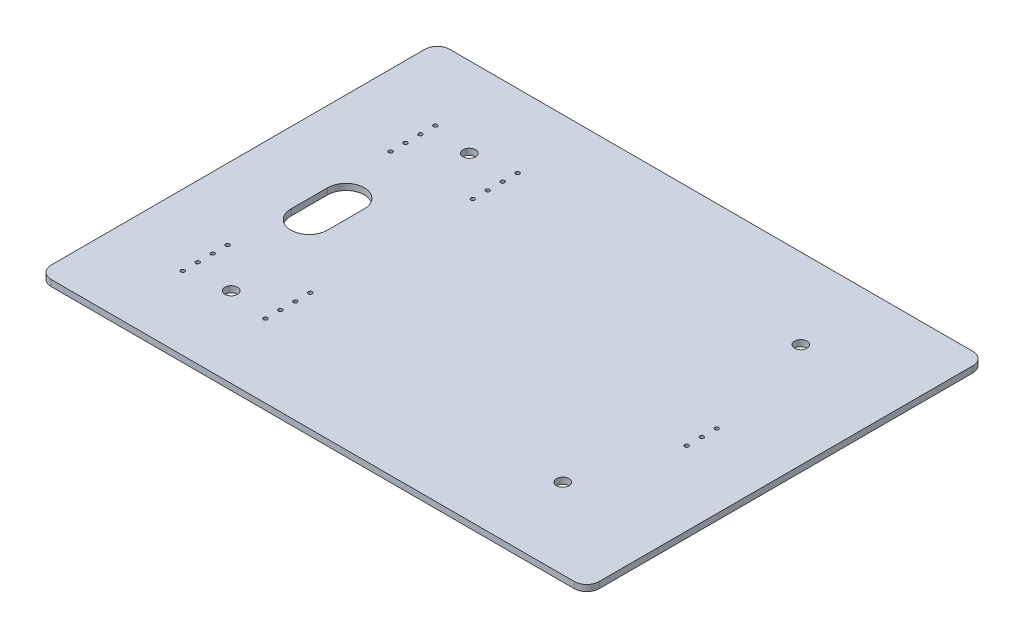
from build123d import *

# Parameters (mm, degrees)
SKETCH1_W           = 139.7
SKETCH1_H           = 101.6
BOSS_EXTRUDE1_DEPTH = 1.5875
SKETCH2_R           = 0.5
SKETCH2_R_2         = 1.5875
CUT_EXTRUDE1_DEPTH  = 87.735242522
CUT_EXTRUDE2_DEPTH  = 87.735242522
FILLET1_R           = 3.175


with BuildPart() as part:
    # Sketch1 → Boss-Extrude1 (new body)
    with BuildSketch(Plane(origin=(0, 0, 0), x_dir=(1, 0, 0), z_dir=(0, 1, 0))):
        with Locations((0.434010551, 0)):
            Rectangle(SKETCH1_W, SKETCH1_H)
    extrude(amount=-BOSS_EXTRUDE1_DEPTH)

    # Sketch2 → Cut-Extrude1 (cut, through all)
    with BuildSketch(Plane(origin=(0, 0, 0), x_dir=(1, 0, 0), z_dir=(0, 1, 0))):
        with Locations(Location((-51.22545, 24.505, 0), (0, 0, 270))):
            Circle(SKETCH2_R)
        with Locations(Location((-30.27045, 28.315, 0), (0, 0, 270))):
            Circle(SKETCH2_R)
        with Locations(Location((-30.27045, 32.125, 0), (0, 0, 270))):
            Circle(SKETCH2_R)
        with Locations(Location((-30.27045, -32.135, 0), (0, 0, 270))):
            Circle(SKETCH2_R)
        with Locations(Location((-30.27045, -28.325, 0), (0, 0, 270))):
            Circle(SKETCH2_R)
        with Locations(Location((-30.27045, -24.515, 0), (0, 0, 270))):
            Circle(SKETCH2_R)
        with Locations(Location((-30.27045, -20.705, 0), (0, 0, 270))):
            Circle(SKETCH2_R)
        with Locations(Location((51.47945, -6.483, 0), (0, 0, 270))):
            Circle(SKETCH2_R)
        with Locations(Location((51.47945, -2.673, 0), (0, 0, 270))):
            Circle(SKETCH2_R)
        with Locations(Location((-51.22545, 28.315, 0), (0, 0, 270))):
            Circle(SKETCH2_R)
        with Locations(Location((-51.22545, 32.125, 0), (0, 0, 270))):
            Circle(SKETCH2_R)
        with Locations(Location((-51.35245, -32.135, 0), (0, 0, 270))):
            Circle(SKETCH2_R)
        with Locations(Location((-51.35245, -28.325, 0), (0, 0, 270))):
            Circle(SKETCH2_R)
        with Locations(Location((-51.35245, -24.515, 0), (0, 0, 270))):
            Circle(SKETCH2_R)
        with Locations(Location((-51.35245, -20.705, 0), (0, 0, 270))):
            Circle(SKETCH2_R)
        with Locations(Location((-30.27045, 20.695, 0), (0, 0, 270))):
            Circle(SKETCH2_R)
        with Locations(Location((-30.27045, 24.505, 0), (0, 0, 270))):
            Circle(SKETCH2_R)
        with Locations(Location((-40.78945, -30.35, 0), (0, 0, 270))):
            Circle(SKETCH2_R_2)
        with Locations(Location((-40.78945, 30.35, 0), (0, 0, 270))):
            Circle(SKETCH2_R_2)
        with Locations(Location((43.71055, 30.35, 0), (0, 0, 270))):
            Circle(SKETCH2_R_2)
        with Locations(Location((43.71055, -30.35, 0), (0, 0, 270))):
            Circle(SKETCH2_R_2)
        with Locations(Location((51.47945, 1.137, 0), (0, 0, 270))):
            Circle(SKETCH2_R)
        with Locations(Location((-51.22545, 20.695, 0), (0, 0, 270))):
            Circle(SKETCH2_R)
    extrude(amount=-CUT_EXTRUDE1_DEPTH, mode=Mode.SUBTRACT)

    # Sketch3 → Cut-Extrude2 (cut, through all)
    with BuildSketch(Plane(origin=(0, 0, 0), x_dir=(1, 0, 0), z_dir=(0, 1, 0))):
        with BuildLine():
            Line((-41.912921413, 4.689952831), (-41.912921413, -4.689952831))
            ThreePointArc((-41.912921413, -4.689952831), (-46.582921413, -9.359952831), (-51.252921413, -4.689952831))
            Line((-51.252921413, -4.689952831), (-51.252921413, 4.689952831))
            ThreePointArc((-51.252921413, 4.689952831), (-46.582921413, 9.359952831), (-41.912921413, 4.689952831))
        make_face()
    extrude(amount=-CUT_EXTRUDE2_DEPTH, mode=Mode.SUBTRACT)

    # Fillet1
    fillet1_edges = [part.edges().sort_by_distance(p)[0] for p in [
        (70.284010551, -0.79375, 50.8),
        (-69.415989449, -0.79375, 50.8),
        (-69.415989449, -0.79375, -50.8),
        (70.284010551, -0.79375, -50.8),
    ]]
    fillet(fillet1_edges, radius=FILLET1_R)


solid = part.part
